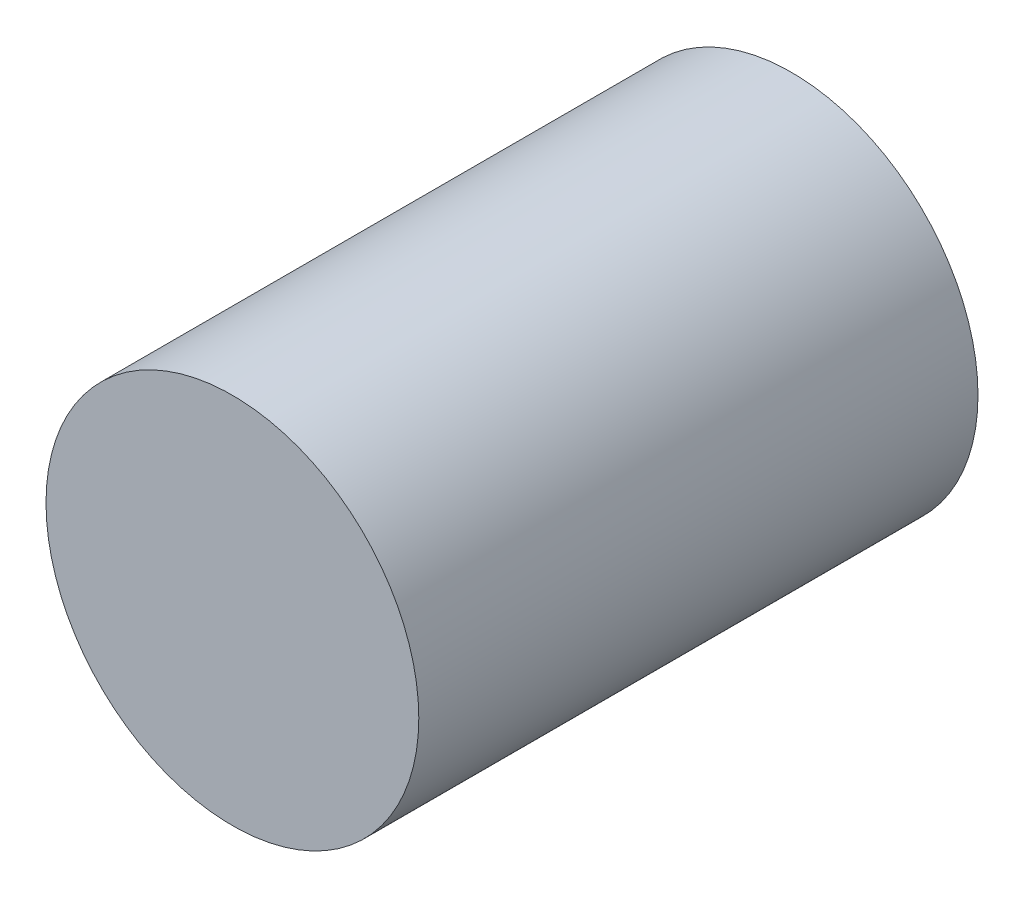
from build123d import *

# Parameters (mm, degrees)
ESQUISSE1_R        = 20
BOSS_EXTRU_1_DEPTH = 30


with BuildPart() as part:
    # Esquisse1 → Boss.-Extru.1 (new, symmetric)
    with BuildSketch(Plane.XY):
        Circle(ESQUISSE1_R)
    extrude(amount=BOSS_EXTRU_1_DEPTH, both=True)


solid = part.part
